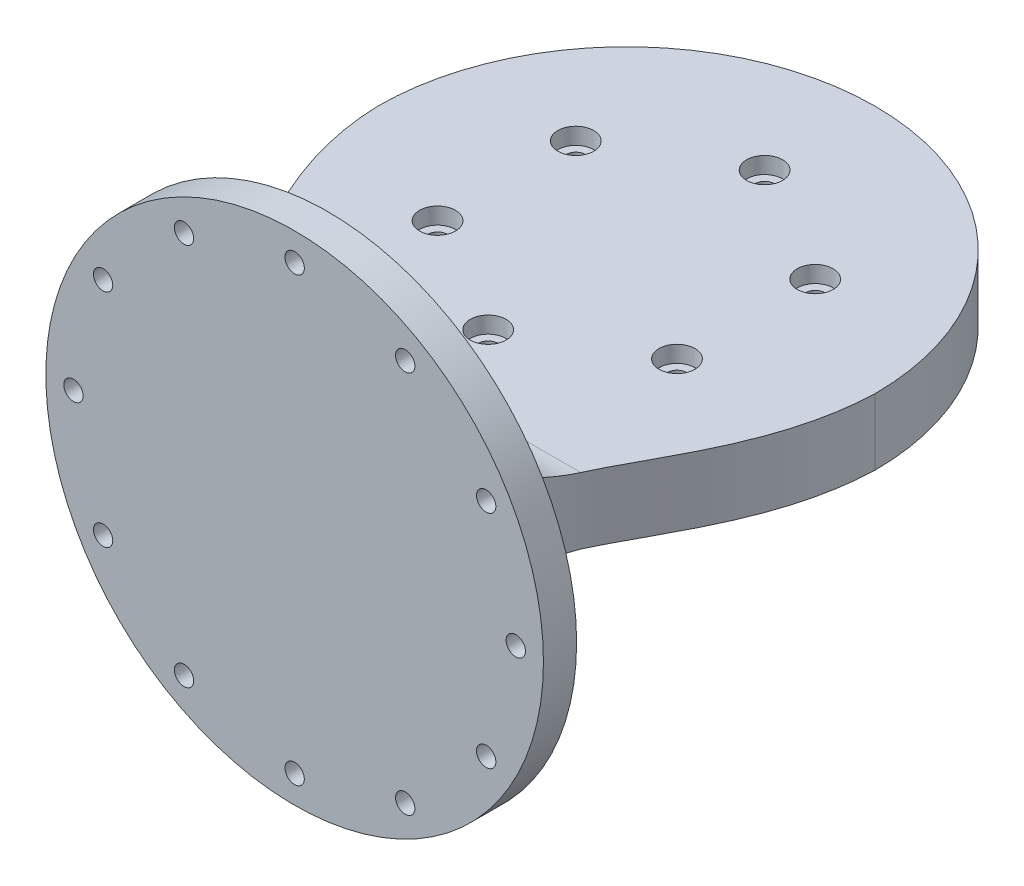
from build123d import *

# Parameters (mm, degrees)
SKETCH1_R                = 45
BOSS_EXTRUDE1_DEPTH      = 12
SKETCH2_R                = 35
CUT_EXTRUDE1_DEPTH       = 6
SKETCH3_R                = 1.75
CUT_EXTRUDE2_DEPTH       = 65.761099435
SKETCH4_R                = 3.25
CUT_EXTRUDE3_DEPTH       = 3
BOSS_EXTRUDE3_START      = -12
BOSS_EXTRUDE3_DEPTH      = 12
SKETCH10_R               = 45
BOSS_EXTRUDE5_DEPTH      = 6
BOSS_EXTRUDE7_DEPTH      = 90
CUT_EXTRUDE14_DEPTH      = 88.464278423
CUT_EXTRUDE14_DEPTH_BACK = 88.464278423
CUT_EXTRUDE15_REACH      = 124.78
SKETCH11_R               = 1.75
SKETCH18_R               = 3.25
CUT_EXTRUDE16_DEPTH      = 3
SKETCH19_R               = 6
CUT_EXTRUDE17_DEPTH      = 118.690271598
CUT_EXTRUDE18_REACH      = 124.78


with BuildPart() as part:
    # Sketch1 → Boss-Extrude1 (new body)
    with BuildSketch(Plane(origin=(0, 0, 0), x_dir=(1, 0, 0), z_dir=(0, 1, 0))):
        with Locations(Location((0, 0, 0), (0, 0, 270))):
            Circle(SKETCH1_R)
    extrude(amount=BOSS_EXTRUDE1_DEPTH)

    # Sketch2 → Cut-Extrude1 (cut)
    with BuildSketch(Plane.XZ):
        with Locations(Location((0, 0, 0), (0, 0, 270))):
            Circle(SKETCH2_R)
    extrude(amount=-CUT_EXTRUDE1_DEPTH, mode=Mode.SUBTRACT)

    # Sketch3 → Cut-Extrude2 (cut, through all)
    with BuildSketch(Plane(origin=(0, 12, 0), x_dir=(1, 0, 0), z_dir=(0, 1, 0))):
        with Locations(Location((0, -25, 0), (0, 0, 270))):
            Circle(SKETCH3_R)
        with Locations(Location((-21.650635095, -12.5, 0), (0, 0, 270))):
            Circle(SKETCH3_R)
        with Locations(Location((-21.650635095, 12.5, 0), (0, 0, 270))):
            Circle(SKETCH3_R)
        with Locations(Location((0, 25, 0), (0, 0, 270))):
            Circle(SKETCH3_R)
        with Locations(Location((21.650635095, 12.5, 0), (0, 0, 270))):
            Circle(SKETCH3_R)
        with Locations(Location((21.650635095, -12.5, 0), (0, 0, 270))):
            Circle(SKETCH3_R)
    extrude(amount=-CUT_EXTRUDE2_DEPTH, mode=Mode.SUBTRACT)

    # Sketch4 → Cut-Extrude3 (cut)
    with BuildSketch(Plane(origin=(0, 12, 0), x_dir=(1, 0, 0), z_dir=(0, 1, 0))):
        with Locations(Location((0, 25, 0), (0, 0, 270))):
            Circle(SKETCH4_R)
        with Locations(Location((21.650635095, 12.5, 0), (0, 0, 270))):
            Circle(SKETCH4_R)
        with Locations(Location((21.650635095, -12.5, 0), (0, 0, 270))):
            Circle(SKETCH4_R)
        with Locations(Location((0, -25, 0), (0, 0, 270))):
            Circle(SKETCH4_R)
        with Locations(Location((-21.650635095, -12.5, 0), (0, 0, 270))):
            Circle(SKETCH4_R)
        with Locations(Location((-21.650635095, 12.5, 0), (0, 0, 270))):
            Circle(SKETCH4_R)
    extrude(amount=-CUT_EXTRUDE3_DEPTH, mode=Mode.SUBTRACT)

    # Sketch5 → Boss-Extrude3 (add)
    with BuildSketch(Plane(origin=(0, 12, 0), x_dir=(1, 0, 0), z_dir=(0, 1, 0)).offset(BOSS_EXTRUDE3_START)):
        with BuildLine():
            ThreePointArc((45, 0), (0, -45), (-45, 0))
            Line((-45, 0), (-45, -60))
            Line((-45, -60), (45, -60))
            Line((45, -60), (45, 0))
        make_face()
    extrude(amount=BOSS_EXTRUDE3_DEPTH)

    # Sketch10 → Boss-Extrude5 (add)
    with BuildSketch(Plane.XY.offset(60)):
        Circle(SKETCH10_R)
    extrude(amount=-BOSS_EXTRUDE5_DEPTH)

    # Sketch17 → Boss-Extrude7 (add, through all)
    with BuildSketch(Plane(origin=(45, 0, 0), x_dir=(0, 0, -1), z_dir=(1, 0, 0))):
        with BuildLine():
            Line((-54, 26.997698388), (-54, 12))
            Line((-54, 12), (-39.002301612, 12))
            ThreePointArc((-39.002301612, 12), (-49.607275844, 16.392724156), (-54, 26.997698388))
        make_face()
        with BuildLine():
            Line((-54, 0), (-54, -14.997698388))
            ThreePointArc((-54, -14.997698388), (-49.607275844, -4.392724156), (-39.002301612, 0))
            Line((-39.002301612, 0), (-54, 0))
        make_face()
    extrude(amount=-BOSS_EXTRUDE7_DEPTH)

    # Sketch14 → Cut-Extrude14 (cut, two sides: drawn at the far end of the back side and taken through both)
    with BuildSketch(Plane.XZ.offset(-CUT_EXTRUDE14_DEPTH_BACK)):
        with BuildLine():
            Line((45, 0), (45, 54))
            Line((45, 54), (33.247528146, 54))
            add(Edge.make_bspline(
                [(45, 0), (44.116517145, 28.32711851), (18.577954425, 44.115755922), (33.247528146, 54)],
                knots=[0, 0, 0, 0, 1, 1, 1, 1], degree=3))
        make_face()
        with BuildLine():
            Line((-45, 54), (-33.247528146, 54))
            add(Edge.make_bspline(
                [(-45, 0), (-44.116517145, 28.32711851), (-18.577954425, 44.115755922), (-33.247528146, 54)],
                knots=[0, 0, 0, 0, 1, 1, 1, 1], degree=3))
            Line((-45, 0), (-45, 54))
        make_face()
    extrude(amount=CUT_EXTRUDE14_DEPTH + CUT_EXTRUDE14_DEPTH_BACK, mode=Mode.SUBTRACT)

    # Sketch11 → Cut-Extrude15 (cut, up to next)
    with BuildSketch(Plane.XY.offset(60), mode=Mode.PRIVATE) as cut_extrude15_sk1:
        with Locations((40, 0)):
            Circle(SKETCH11_R)
    cut_extrude15_tool1 = extrude(cut_extrude15_sk1.sketch, amount=-CUT_EXTRUDE15_REACH, mode=Mode.PRIVATE) & part.part
    # Sketch11 → Cut-Extrude15 (cut, up to next)
    with BuildSketch(Plane.XY.offset(60), mode=Mode.PRIVATE) as cut_extrude15_sk2:
        with Locations((34.641016151, -20)):
            Circle(SKETCH11_R)
    cut_extrude15_tool2 = extrude(cut_extrude15_sk2.sketch, amount=-CUT_EXTRUDE15_REACH, mode=Mode.PRIVATE) & part.part
    # Sketch11 → Cut-Extrude15 (cut, up to next)
    with BuildSketch(Plane.XY.offset(60), mode=Mode.PRIVATE) as cut_extrude15_sk3:
        with Locations((20, -34.641016151)):
            Circle(SKETCH11_R)
    cut_extrude15_tool3 = extrude(cut_extrude15_sk3.sketch, amount=-CUT_EXTRUDE15_REACH, mode=Mode.PRIVATE) & part.part
    # Sketch11 → Cut-Extrude15 (cut, up to next)
    with BuildSketch(Plane.XY.offset(60), mode=Mode.PRIVATE) as cut_extrude15_sk4:
        with Locations((0, -40)):
            Circle(SKETCH11_R)
    cut_extrude15_tool4 = extrude(cut_extrude15_sk4.sketch, amount=-CUT_EXTRUDE15_REACH, mode=Mode.PRIVATE) & part.part
    # Sketch11 → Cut-Extrude15 (cut, up to next)
    with BuildSketch(Plane.XY.offset(60), mode=Mode.PRIVATE) as cut_extrude15_sk5:
        with Locations((-20, -34.641016151)):
            Circle(SKETCH11_R)
    cut_extrude15_tool5 = extrude(cut_extrude15_sk5.sketch, amount=-CUT_EXTRUDE15_REACH, mode=Mode.PRIVATE) & part.part
    # Sketch11 → Cut-Extrude15 (cut, up to next)
    with BuildSketch(Plane.XY.offset(60), mode=Mode.PRIVATE) as cut_extrude15_sk6:
        with Locations((-34.641016151, -20)):
            Circle(SKETCH11_R)
    cut_extrude15_tool6 = extrude(cut_extrude15_sk6.sketch, amount=-CUT_EXTRUDE15_REACH, mode=Mode.PRIVATE) & part.part
    # Sketch11 → Cut-Extrude15 (cut, up to next)
    with BuildSketch(Plane.XY.offset(60), mode=Mode.PRIVATE) as cut_extrude15_sk7:
        with Locations((-40, 0)):
            Circle(SKETCH11_R)
    cut_extrude15_tool7 = extrude(cut_extrude15_sk7.sketch, amount=-CUT_EXTRUDE15_REACH, mode=Mode.PRIVATE) & part.part
    # Sketch11 → Cut-Extrude15 (cut, up to next)
    with BuildSketch(Plane.XY.offset(60), mode=Mode.PRIVATE) as cut_extrude15_sk8:
        with Locations((-34.641016151, 20)):
            Circle(SKETCH11_R)
    cut_extrude15_tool8 = extrude(cut_extrude15_sk8.sketch, amount=-CUT_EXTRUDE15_REACH, mode=Mode.PRIVATE) & part.part
    # Sketch11 → Cut-Extrude15 (cut, up to next)
    with BuildSketch(Plane.XY.offset(60), mode=Mode.PRIVATE) as cut_extrude15_sk9:
        with Locations((-20, 34.641016151)):
            Circle(SKETCH11_R)
    cut_extrude15_tool9 = extrude(cut_extrude15_sk9.sketch, amount=-CUT_EXTRUDE15_REACH, mode=Mode.PRIVATE) & part.part
    # Sketch11 → Cut-Extrude15 (cut, up to next)
    with BuildSketch(Plane.XY.offset(60), mode=Mode.PRIVATE) as cut_extrude15_sk10:
        with Locations((0, 40)):
            Circle(SKETCH11_R)
    cut_extrude15_tool10 = extrude(cut_extrude15_sk10.sketch, amount=-CUT_EXTRUDE15_REACH, mode=Mode.PRIVATE) & part.part
    # Sketch11 → Cut-Extrude15 (cut, up to next)
    with BuildSketch(Plane.XY.offset(60), mode=Mode.PRIVATE) as cut_extrude15_sk11:
        with Locations((20, 34.641016151)):
            Circle(SKETCH11_R)
    cut_extrude15_tool11 = extrude(cut_extrude15_sk11.sketch, amount=-CUT_EXTRUDE15_REACH, mode=Mode.PRIVATE) & part.part
    # Sketch11 → Cut-Extrude15 (cut, up to next)
    with BuildSketch(Plane.XY.offset(60), mode=Mode.PRIVATE) as cut_extrude15_sk12:
        with Locations((34.641016151, 20)):
            Circle(SKETCH11_R)
    cut_extrude15_tool12 = extrude(cut_extrude15_sk12.sketch, amount=-CUT_EXTRUDE15_REACH, mode=Mode.PRIVATE) & part.part
    add(cut_extrude15_tool1.solids().sort_by_distance((40, 0, 60))[0], mode=Mode.SUBTRACT)
    add(cut_extrude15_tool2.solids().sort_by_distance((34.641016, -20, 60))[0], mode=Mode.SUBTRACT)
    add(cut_extrude15_tool3.solids().sort_by_distance((20, -34.641016, 60))[0], mode=Mode.SUBTRACT)
    add(cut_extrude15_tool4.solids().sort_by_distance((0, -40, 60))[0], mode=Mode.SUBTRACT)
    add(cut_extrude15_tool5.solids().sort_by_distance((-20, -34.641016, 60))[0], mode=Mode.SUBTRACT)
    add(cut_extrude15_tool6.solids().sort_by_distance((-34.641016, -20, 60))[0], mode=Mode.SUBTRACT)
    add(cut_extrude15_tool7.solids().sort_by_distance((-40, 0, 60))[0], mode=Mode.SUBTRACT)
    add(cut_extrude15_tool8.solids().sort_by_distance((-34.641016, 20, 60))[0], mode=Mode.SUBTRACT)
    add(cut_extrude15_tool9.solids().sort_by_distance((-20, 34.641016, 60))[0], mode=Mode.SUBTRACT)
    add(cut_extrude15_tool10.solids().sort_by_distance((0, 40, 60))[0], mode=Mode.SUBTRACT)
    add(cut_extrude15_tool11.solids().sort_by_distance((20, 34.641016, 60))[0], mode=Mode.SUBTRACT)
    add(cut_extrude15_tool12.solids().sort_by_distance((34.641016, 20, 60))[0], mode=Mode.SUBTRACT)

    # Sketch18 → Cut-Extrude16 (cut)
    with BuildSketch(Plane(origin=(0, 0, 54), x_dir=(-1, 0, 0), z_dir=(0, 0, -1))):
        with Locations((0, 40)):
            Circle(SKETCH18_R)
        with Locations((20, 34.641016151)):
            Circle(SKETCH18_R)
        with Locations((34.641016151, 20)):
            Circle(SKETCH18_R)
        with Locations((40, 0)):
            Circle(SKETCH18_R)
        with Locations((34.641016151, -20)):
            Circle(SKETCH18_R)
        with Locations((20, -34.641016151)):
            Circle(SKETCH18_R)
        with Locations((0, -40)):
            Circle(SKETCH18_R)
        with Locations((-20, -34.641016151)):
            Circle(SKETCH18_R)
        with Locations((-34.641016151, -20)):
            Circle(SKETCH18_R)
        with Locations((-40, 0)):
            Circle(SKETCH18_R)
        with Locations((-34.641016151, 20)):
            Circle(SKETCH18_R)
        with Locations((-20, 34.641016151)):
            Circle(SKETCH18_R)
    extrude(amount=-CUT_EXTRUDE16_DEPTH, mode=Mode.SUBTRACT)

    # Sketch19 → Cut-Extrude17 (cut, through all)
    with BuildSketch(Plane(origin=(0, 0, 54), x_dir=(-1, 0, 0), z_dir=(0, 0, -1))):
        with Locations((-34.641016151, 20)):
            Circle(SKETCH19_R)
        with Locations((34.641016151, 20)):
            Circle(SKETCH19_R)
        with Locations((-34.641016151, -20)):
            Circle(SKETCH19_R)
        with Locations((34.641016151, -20)):
            Circle(SKETCH19_R)
    extrude(amount=CUT_EXTRUDE17_DEPTH, mode=Mode.SUBTRACT)

    # Sketch20 → Cut-Extrude18 (cut, up to next)
    with BuildSketch(Plane.XY.offset(60), mode=Mode.PRIVATE) as cut_extrude18_sk1:
        with BuildLine():
            Line((-43.370496884, 12), (-45, 12))
            Line((-45, 12), (-45, 0))
            ThreePointArc((-45, 0), (-44.590763392, 6.055065656), (-43.370496884, 12))
        make_face()
    cut_extrude18_tool1 = extrude(cut_extrude18_sk1.sketch, amount=-CUT_EXTRUDE18_REACH, mode=Mode.PRIVATE) & part.part
    # Sketch20 → Cut-Extrude18 (cut, up to next)
    with BuildSketch(Plane.XY.offset(60), mode=Mode.PRIVATE) as cut_extrude18_sk2:
        with BuildLine():
            Line((45, 12), (45, 0))
            ThreePointArc((45, 0), (44.590763392, 6.055065656), (43.370496884, 12))
            Line((43.370496884, 12), (45, 12))
        make_face()
    cut_extrude18_tool2 = extrude(cut_extrude18_sk2.sketch, amount=-CUT_EXTRUDE18_REACH, mode=Mode.PRIVATE) & part.part
    add(cut_extrude18_tool1.solids().sort_by_distance((-44.512705, 9.010971, 60))[0], mode=Mode.SUBTRACT)
    add(cut_extrude18_tool2.solids().sort_by_distance((44.512705, 9.010971, 60))[0], mode=Mode.SUBTRACT)


solid = part.part
